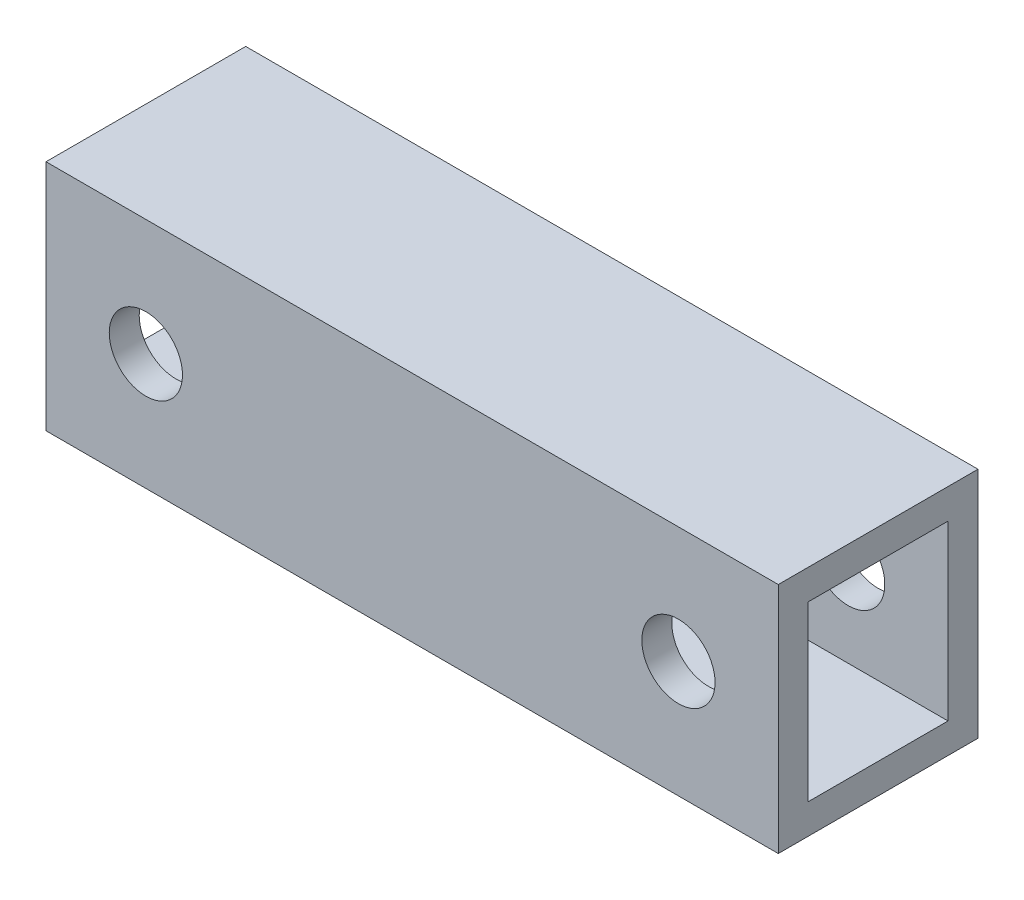
from build123d import *

# Parameters (mm, degrees)
SOFT_CONTACT_AND_WRAP_START     = -1
SOFT_CONTACT_AND_WRAP_PROFILE_W = 22
SOFT_CONTACT_AND_WRAP_PROFILE_H = 7
SOFT_CONTACT_AND_WRAP_DEPTH     = 6
SLIP_POCKET_START               = -0.1
FIXED_BAR_SLIP_POCKET_PROFILE_W = 24
FIXED_BAR_SLIP_POCKET_PROFILE_H = 5.2
SLIP_POCKET_DEPTH               = 4.2
PAD_CAPTURE_M2_START            = -50
PAD_CAPTURE_M2_PROFILE_R        = 1.1
PAD_CAPTURE_M2_DEPTH            = 129.038452061


with BuildPart() as part:
    # Soft_contact_and_wrap_profile → Soft_contact_and_wrap (new body)
    with BuildSketch(Plane.XY.offset(SOFT_CONTACT_AND_WRAP_START)):
        with Locations((65, -13.5)):
            Rectangle(SOFT_CONTACT_AND_WRAP_PROFILE_W, SOFT_CONTACT_AND_WRAP_PROFILE_H)
    extrude(amount=SOFT_CONTACT_AND_WRAP_DEPTH)

    # Fixed_bar_slip_pocket_profile → Slip_pocket (cut)
    with BuildSketch(Plane.XY.offset(SLIP_POCKET_START)):
        with Locations((65, -13.5)):
            Rectangle(FIXED_BAR_SLIP_POCKET_PROFILE_W, FIXED_BAR_SLIP_POCKET_PROFILE_H)
    extrude(amount=SLIP_POCKET_DEPTH, mode=Mode.SUBTRACT)

    # Pad_capture_M2_profile → Pad_capture_M2 (cut, through all)
    with BuildSketch(Plane.XY.offset(PAD_CAPTURE_M2_START)):
        with Locations(Location((57, -13.5, 0), (0, 0, 180))):
            Circle(PAD_CAPTURE_M2_PROFILE_R)
        with Locations(Location((73, -13.5, 0), (0, 0, 180))):
            Circle(PAD_CAPTURE_M2_PROFILE_R)
    extrude(amount=PAD_CAPTURE_M2_DEPTH, mode=Mode.SUBTRACT)


solid = part.part
